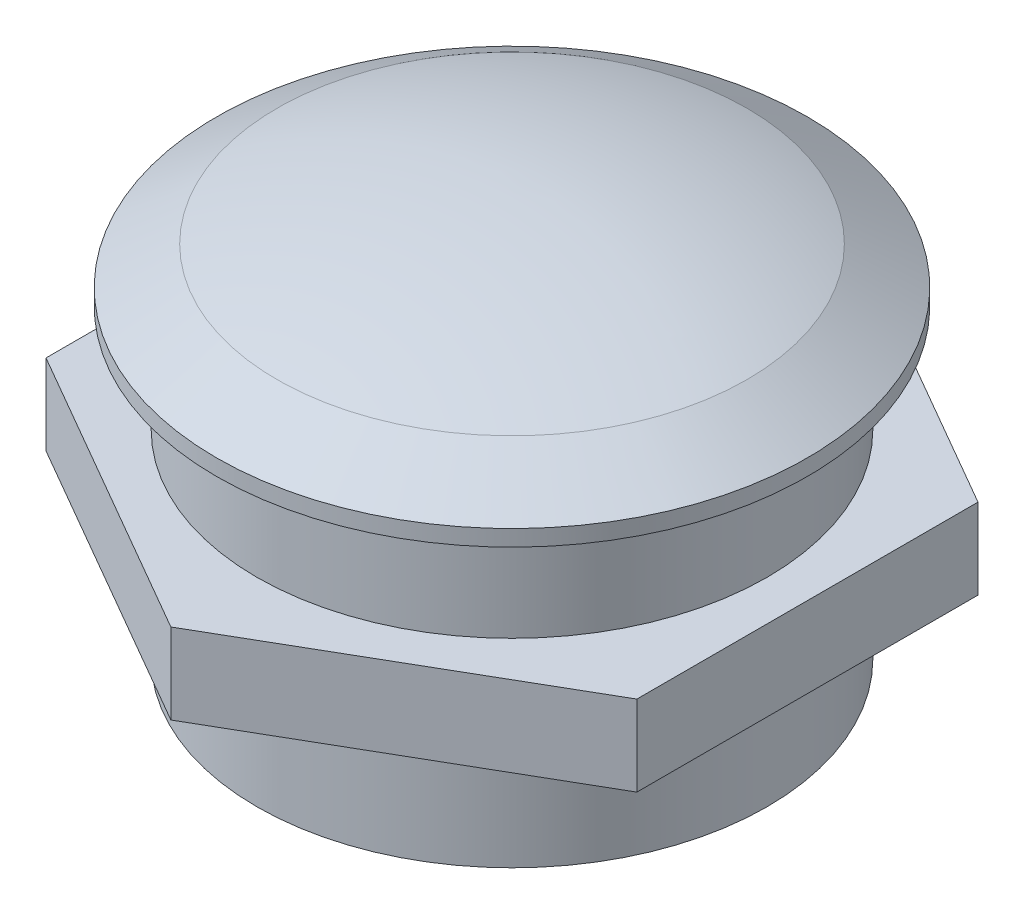
from build123d import *

# Parameters (mm, degrees)
BOSS_EXTRUDE2_START = 4
BOSS_EXTRUDE2_DEPTH = 3


with BuildPart() as part:
    # Sketch1 → Revolve1 (revolve)
    with BuildSketch(Plane.XY, mode=Mode.PRIVATE) as revolve1_sk:
        with BuildLine():
            Line((9.5, 0), (11, 0))
            Line((11, 0), (11, 0.6))
            Line((11, 0.6), (8.75, 2))
            ThreePointArc((8.75, 2), (4.447541456, 3.196711086), (0, 3.6))
            Line((0, 3.6), (0, -11.4))
            Line((0, -11.4), (9.5, -11.4))
            Line((9.5, -11.4), (9.5, 0))
        make_face()
    revolve(revolve1_sk.sketch.rotate(Axis((0, 3.6, 0), (0, 1, 0)), 90), axis=Axis((0, 3.6, 0), (0, 1, 0)))

    # Sketch3 → Boss-Extrude2 (add)
    with BuildSketch(Plane.XZ.offset(BOSS_EXTRUDE2_START)):
        Polygon((0, 12.701705922), (-11, 6.350852961), (-11, -6.350852961), (0, -12.701705922), (11, -6.350852961), (11, 6.350852961), align=None)
    extrude(amount=BOSS_EXTRUDE2_DEPTH)


solid = part.part
